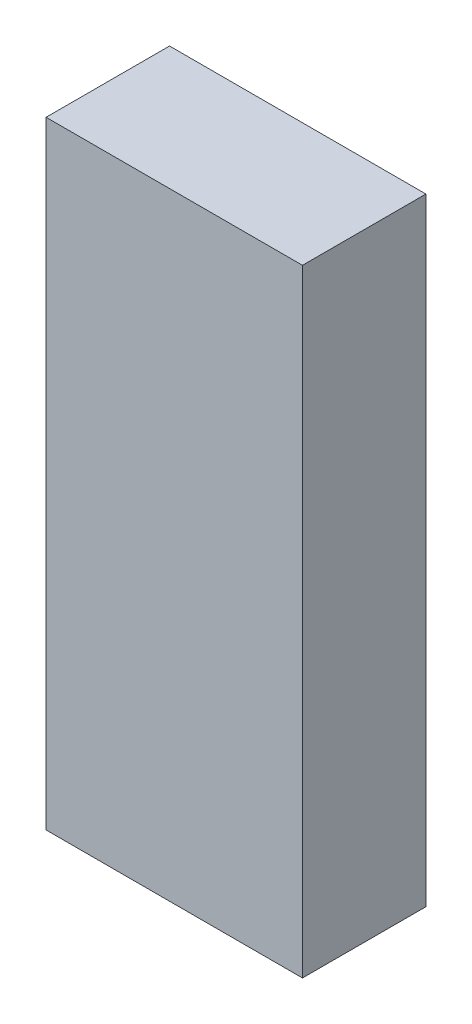
from build123d import *

# Parameters (mm, degrees)
ESQUISSE1_W        = 27
ESQUISSE1_H        = 65
BOSS_EXTRU_1_DEPTH = 13


with BuildPart() as part:
    # Esquisse1 → Boss.-Extru.1 (new body)
    with BuildSketch(Plane.XY):
        with Locations((-13.5, 32.5)):
            Rectangle(ESQUISSE1_W, ESQUISSE1_H)
    extrude(amount=BOSS_EXTRU_1_DEPTH)


solid = part.part
